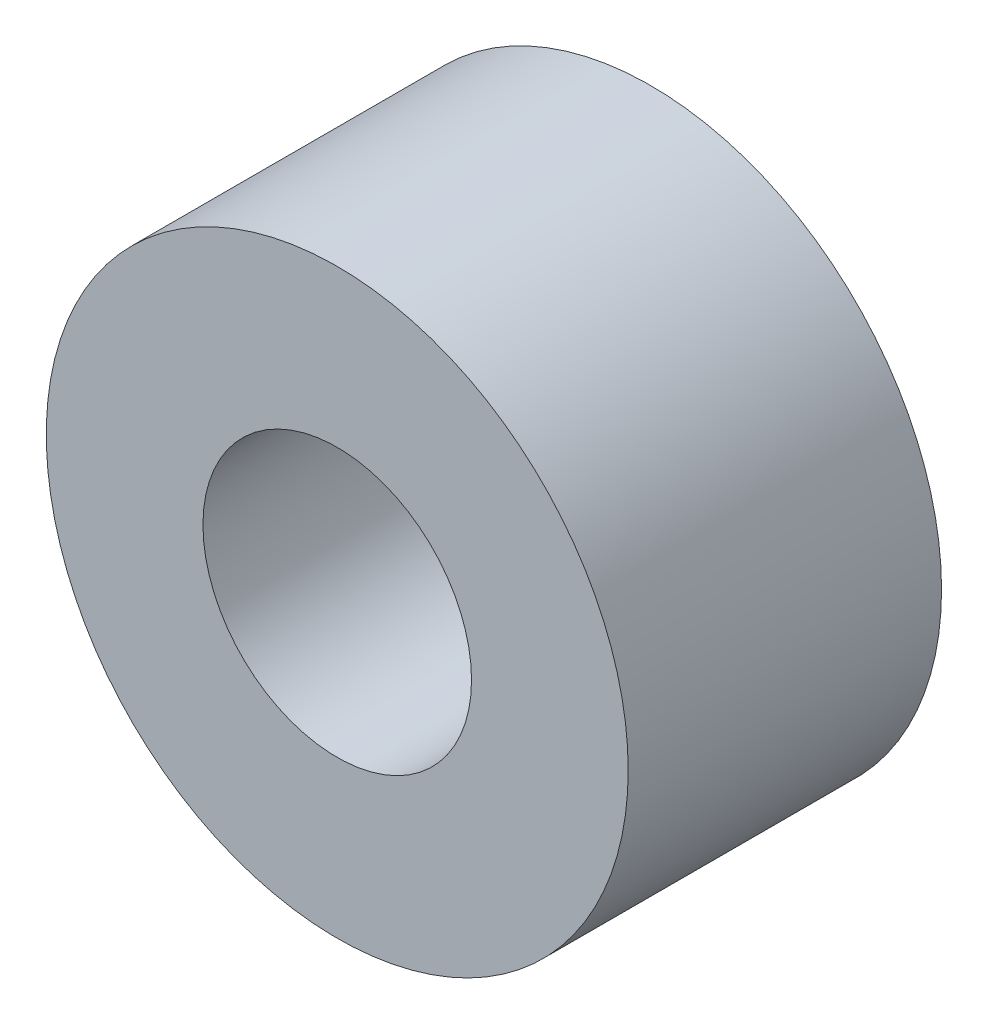
from build123d import *

# Parameters (mm, degrees)
SKETCH1_R           = 6.5
SKETCH1_R_2         = 3
BOSS_EXTRUDE1_DEPTH = 7


with BuildPart() as part:
    # Sketch1 → Boss-Extrude1 (new body)
    with BuildSketch(Plane.XY):
        Circle(SKETCH1_R)
        Circle(SKETCH1_R_2, mode=Mode.SUBTRACT)
    extrude(amount=BOSS_EXTRUDE1_DEPTH)


solid = part.part
